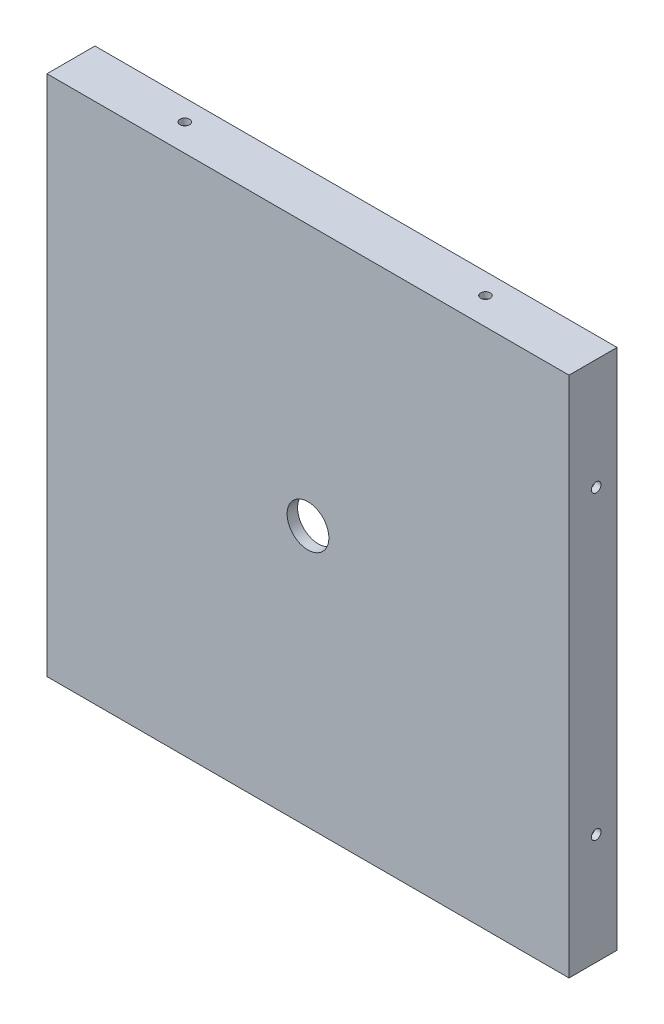
from build123d import *

# Parameters (mm, degrees)
SKETCH_1_W               = 250
SKETCH_1_H               = 250
SKETCH_1_R               = 10
EXTRUDE_1_DEPTH          = 5
SKETCH_3_W               = 250
SKETCH_3_H               = 250
SKETCH_3_W_2             = 244
SKETCH_3_H_2             = 244
EXTRUDE_2_DEPTH          = 18
HOLE_WIZARD_M4_1_D       = 4.6
HOLE_WIZARD_M4_1_DEPTH   = 3
PATTERN_CIRCULAR_1_COUNT = 4


with BuildPart() as part:
    # 스케치1 → 보스-돌출1 (new body)
    with BuildSketch(Plane.XY):
        Rectangle(SKETCH_1_W, SKETCH_1_H)
        Circle(SKETCH_1_R, mode=Mode.SUBTRACT)
    extrude(amount=EXTRUDE_1_DEPTH)

    # 스케치3 → 보스-돌출2 (add)
    with BuildSketch(Plane(origin=(0, 0, 0), x_dir=(-1, 0, 0), z_dir=(0, 0, -1))):
        Rectangle(SKETCH_3_W, SKETCH_3_H)
        Rectangle(SKETCH_3_W_2, SKETCH_3_H_2, mode=Mode.SUBTRACT)
    extrude(amount=EXTRUDE_2_DEPTH)

    # M4 여유 구멍1
    with Locations(Plane.ZY.offset(-122)):
        with Locations((-8, 72), (-8, -72)):
            hole_wizard_m4_1 = Hole(HOLE_WIZARD_M4_1_D / 2, depth=HOLE_WIZARD_M4_1_DEPTH)

    # 원형 패턴1: M4 여유 구멍1 ×4 about axis
    pattern_circular_1_axis = Axis((0, 0, 0), (0, 0, 1))
    for i in range(1, PATTERN_CIRCULAR_1_COUNT):
        add(hole_wizard_m4_1.rotate(pattern_circular_1_axis, i * 360 / PATTERN_CIRCULAR_1_COUNT), mode=Mode.SUBTRACT)


solid = part.part
